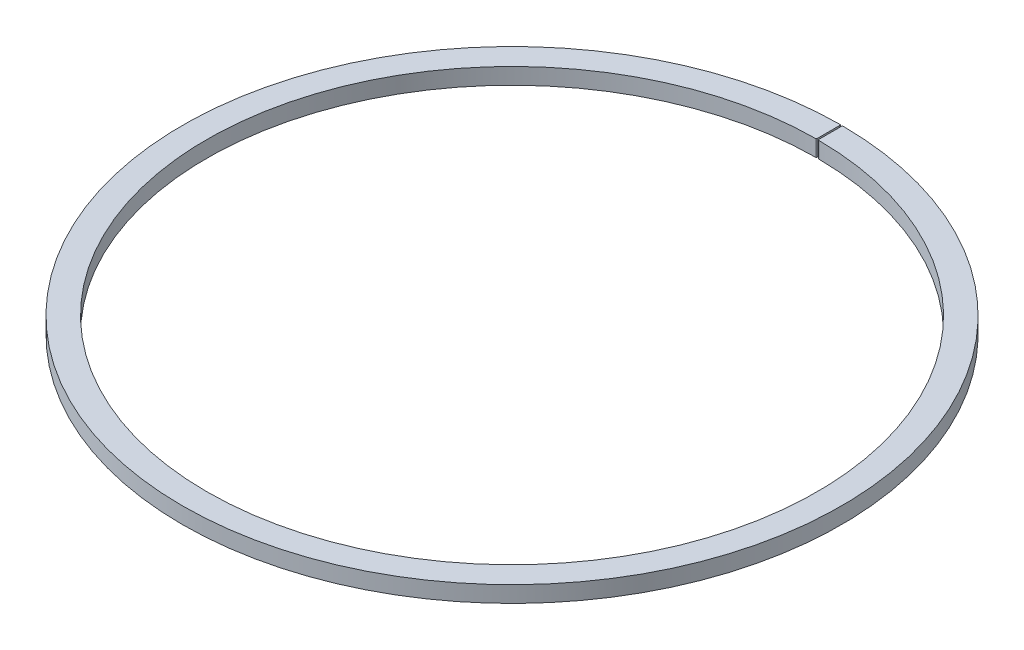
from build123d import *

# Parameters (mm, degrees)
BOSS_EXTRUDE1_DEPTH = 2
FILLET1_R           = 0.1


with BuildPart() as part:
    # Sketch1 → Boss-Extrude1 (new body)
    with BuildSketch(Plane(origin=(0, 0, 0), x_dir=(1, 0, 0), z_dir=(0, 1, 0))):
        with BuildLine():
            Line((0.1, 40.499876543), (0.1, 37.499866666))
            ThreePointArc((0.1, 37.499866666), (26.551836095, 26.481125354), (37.5, 0))
            ThreePointArc((37.5, 0), (-26.481125354, -26.551836095), (-0.1, 37.499866666))
            Line((-0.1, 37.499866666), (-0.1, 40.499876543))
            ThreePointArc((-0.1, 40.499876543), (-28.602447448, -28.67315818), (40.5, 0))
            ThreePointArc((40.5, 0), (28.67315818, 28.602447448), (0.1, 40.499876543))
        make_face()
    extrude(amount=BOSS_EXTRUDE1_DEPTH)

    # Fillet1
    fillet1_edges = [part.edges().sort_by_distance(p)[0] for p in [
        (-0.1, 1, -37.499866666),
        (0.1, 1, -37.499866666),
        (0.1, 1, -40.499876543),
        (-0.1, 1, -40.499876543),
    ]]
    fillet(fillet1_edges, radius=FILLET1_R)


solid = part.part
